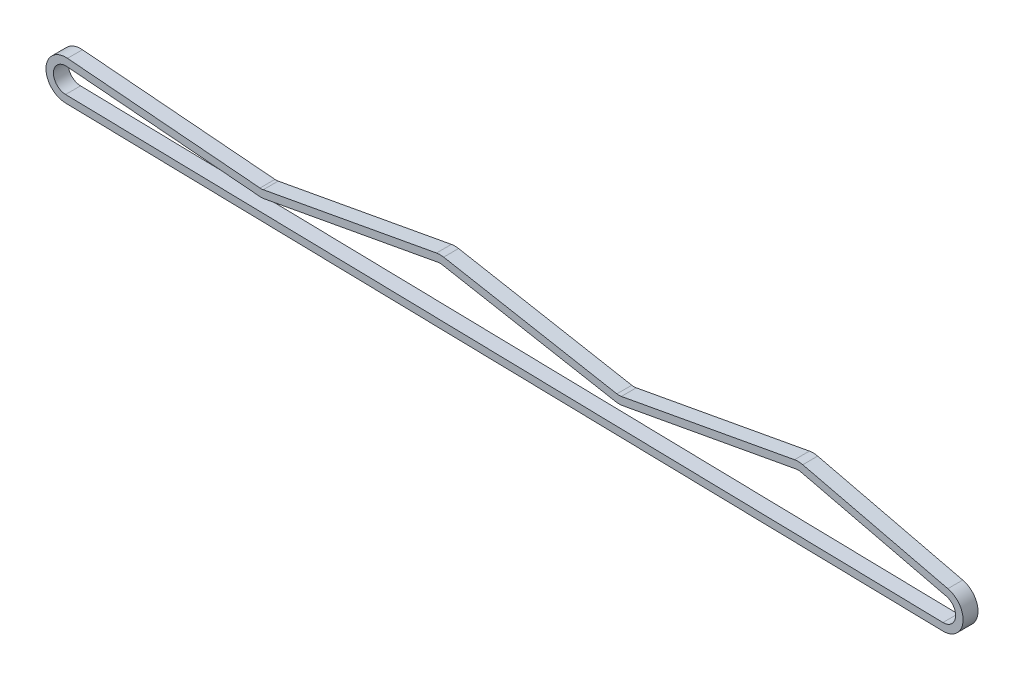
from build123d import *

# Parameters (mm, degrees)
BOSS_EXTRUDE1_DEPTH = 3


with BuildPart() as part:
    # Sketch1 → Boss-Extrude1 (new, symmetric)
    with BuildSketch(Plane.XY):
        with BuildLine():
            Line((157.201895781, -12.998193365), (-195.641912802, -5.498193365))
            ThreePointArc((-195.641912802, -5.498193365), (-203.460999592, 2.917559906), (-194.807193354, 10.472337133))
            Line((-194.807193354, 10.472337133), (-117.387348628, 4.017289292))
            ThreePointArc((-117.387348628, 4.017289292), (-116.726087197, 4.00604626), (-116.069126514, 4.082176062))
            Line((-116.069126514, 4.082176062), (-46.416348736, 16.868518301))
            ThreePointArc((-46.416348736, 16.868518301), (-44.971904292, 17), (-43.527459847, 16.868518301))
            Line((-43.527459847, 16.868518301), (26.125317931, 4.082176062))
            ThreePointArc((26.125317931, 4.082176062), (27.028095708, 4), (27.930873486, 4.082176062))
            Line((27.930873486, 4.082176062), (97.583651264, 16.868518301))
            ThreePointArc((97.583651264, 16.868518301), (99.243881438, 16.997089253), (100.894762375, 16.779174478))
            Line((100.894762375, 16.779174478), (159.238570958, 2.779174478))
            ThreePointArc((159.238570958, 2.779174478), (165.306070677, -6.024208847), (157.201895781, -12.998193365))
        make_face()
        with BuildLine():
            Line((-195.056459955, 7.482710708), (-117.63661523, 1.027662867))
            ThreePointArc((-117.63661523, 1.027662867), (-116.57859694, 1.009674016), (-115.527459847, 1.131481699))
            Line((-115.527459847, 1.131481699), (-45.874682069, 13.917823938))
            ThreePointArc((-45.874682069, 13.917823938), (-44.971904292, 14), (-44.069126514, 13.917823938))
            Line((-44.069126514, 13.917823938), (25.583651264, 1.131481699))
            ThreePointArc((25.583651264, 1.131481699), (27.028095708, 1), (28.472540153, 1.131481699))
            Line((28.472540153, 1.131481699), (98.125317931, 13.917823938))
            ThreePointArc((98.125317931, 13.917823938), (99.162961789, 13.998180783), (100.194762375, 13.861984049))
            Line((100.194762375, 13.861984049), (158.538570958, -0.138015951))
            ThreePointArc((158.538570958, -0.138015951), (162.330758283, -5.640130529), (157.265648973, -9.998870853))
            Line((157.265648973, -9.998870853), (-195.578159611, -2.498870853))
            ThreePointArc((-195.578159611, -2.498870853), (-200.465088855, 2.760974942), (-195.056459955, 7.482710708))
        make_face(mode=Mode.SUBTRACT)
    extrude(amount=BOSS_EXTRUDE1_DEPTH, both=True)


solid = part.part
